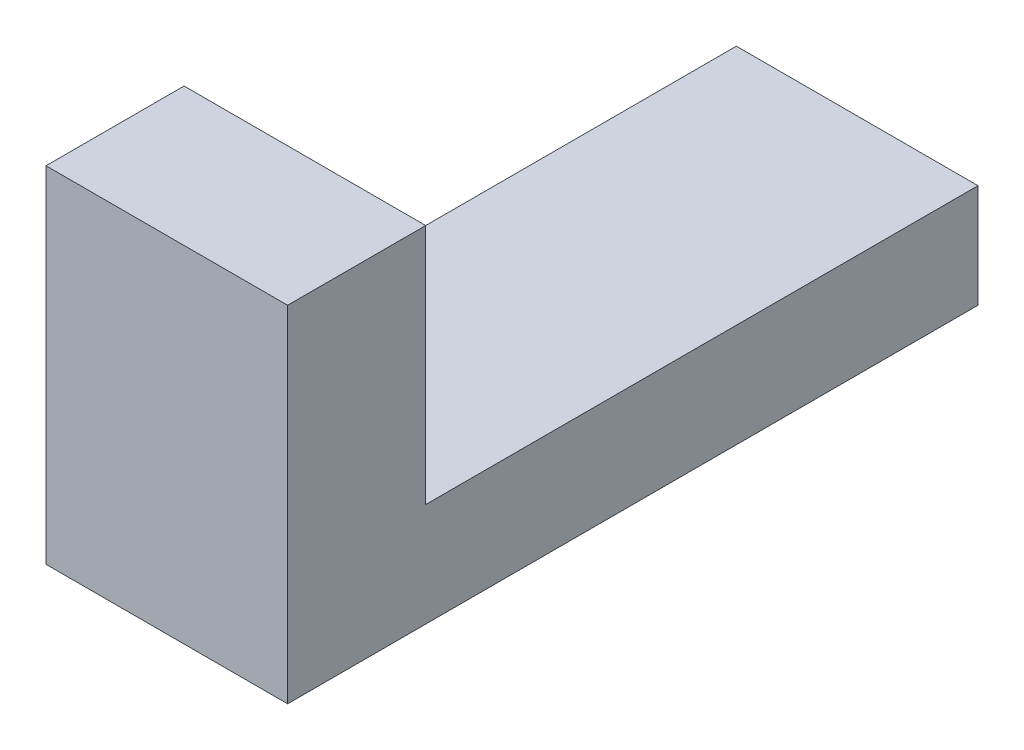
from build123d import *

# Parameters (mm, degrees)
SKETCH_1_W      = 7
SKETCH_1_H      = 3
EXTRUDE_1_DEPTH = 20
SKETCH_2_W      = 7
SKETCH_2_H      = 4
EXTRUDE_2_DEPTH = 7


with BuildPart() as part:
    # 草图1 → 凸台-拉伸1 (new body)
    with BuildSketch(Plane.XY):
        with Locations((3.5, 1.5)):
            Rectangle(SKETCH_1_W, SKETCH_1_H)
    extrude(amount=EXTRUDE_1_DEPTH)

    # 草图2 → 凸台-拉伸2 (add)
    with BuildSketch(Plane(origin=(0, 3, 0), x_dir=(1, 0, 0), z_dir=(0, 1, 0))):
        with Locations((3.5, -18)):
            Rectangle(SKETCH_2_W, SKETCH_2_H)
    extrude(amount=EXTRUDE_2_DEPTH)


solid = part.part
